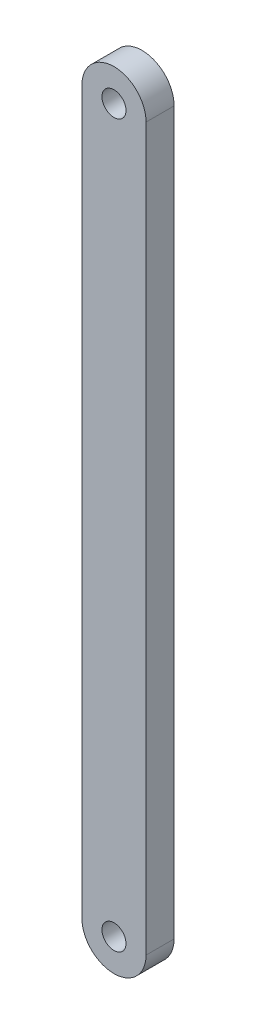
from build123d import *

# Parameters (mm, degrees)
SKETCH1_R           = 1.5
BOSS_EXTRUDE1_DEPTH = 3.5


with BuildPart() as part:
    # Sketch1 → Boss-Extrude1 (new body)
    with BuildSketch(Plane.XY):
        with BuildLine():
            Line((-4, 90), (-4, 0))
            ThreePointArc((-4, 0), (0, -4), (4, 0))
            Line((4, 0), (4, 90))
            ThreePointArc((4, 90), (0, 94), (-4, 90))
        make_face()
        with Locations((0, 90)):
            Circle(SKETCH1_R, mode=Mode.SUBTRACT)
        Circle(SKETCH1_R, mode=Mode.SUBTRACT)
    extrude(amount=BOSS_EXTRUDE1_DEPTH)


solid = part.part
